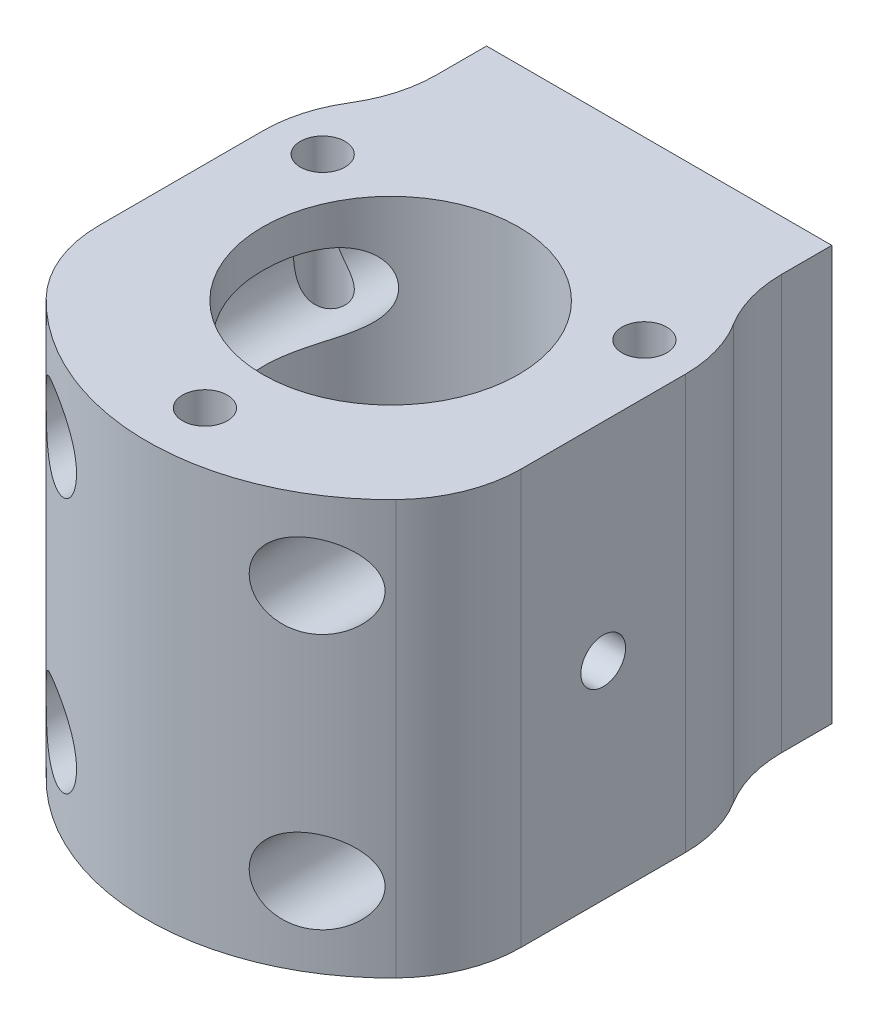
from build123d import *

# Parameters (mm, degrees)
ESQUISSE1_W                  = 27
ESQUISSE1_H                  = 32.4
BOSS_EXTRU_1_DEPTH           = 3
ESQUISSE3_R                  = 10
BOSS_EXTRU_2_DEPTH           = 32.4
CONG_1_R                     = 10
ENL_V_MAT_EXTRU_1_REACH      = 49.216
ESQUISSE2_R                  = 1.5
ENL_V_MAT_EXTRU_2_REACH      = 56.924
ESQUISSE4_R                  = 1.75
R_P_TITION_CIRCULAIRE1_COUNT = 3
ENL_V_MAT_EXTRU_3_REACH      = 46.699
ESQUISSE5_R                  = 3.25
ENL_V_MAT_EXTRU_5_REACH      = 56.924
CONG_2_R                     = 10
ENL_V_MAT_EXTRU_6_REACH      = 56.364
ESQUISSE8_R                  = 1.75
ENL_V_MAT_EXTRU_7_REACH      = 54.597
ENL_V_MAT_EXTRU_7_END_RADIUS = 10


with BuildPart() as part:
    # Esquisse1 → Boss.-Extru.1 (new body)
    with BuildSketch(Plane.XY):
        Rectangle(ESQUISSE1_W, ESQUISSE1_H)
    extrude(amount=BOSS_EXTRU_1_DEPTH)

    # Esquisse3 → Boss.-Extru.2 (add)
    with BuildSketch(Plane.XZ.offset(16.2)):
        with BuildLine():
            Line((-13.5, 3), (-13.5, 7.559296893))
            ThreePointArc((-13.5, 7.559296893), (0, 40.05), (13.5, 7.559296893))
            Line((13.5, 7.559296893), (13.5, 3))
            Line((13.5, 3), (13.5, 0))
            Line((13.5, 0), (-13.5, 0))
            Line((-13.5, 0), (-13.5, 3))
        make_face()
        with Locations(Location((0, 21, 0), (0, 0, 270))):
            Circle(ESQUISSE3_R, mode=Mode.SUBTRACT)
    extrude(amount=-BOSS_EXTRU_2_DEPTH)

    # Congé1
    cong_1_edges = [part.edges().sort_by_distance(p)[0] for p in [
        (13.5, 0, 7.559296893),
        (-13.5, 0, 7.559296893),
    ]]
    fillet(cong_1_edges, radius=CONG_1_R)

    # Esquisse2 → Enlèv. mat.-Extru.1 (cut, up to next)
    with BuildSketch(Plane.XY, mode=Mode.PRIVATE) as enl_v_mat_extru_1_sk1:
        with Locations(Location((-10, 10, 0), (0, 0, 180))):
            Circle(ESQUISSE2_R)
    enl_v_mat_extru_1_tool1 = extrude(enl_v_mat_extru_1_sk1.sketch, amount=ENL_V_MAT_EXTRU_1_REACH, mode=Mode.PRIVATE) & part.part
    # Esquisse2 → Enlèv. mat.-Extru.1 (cut, up to next)
    with BuildSketch(Plane.XY, mode=Mode.PRIVATE) as enl_v_mat_extru_1_sk2:
        with Locations(Location((10, 10, 0), (0, 0, 180))):
            Circle(ESQUISSE2_R)
    enl_v_mat_extru_1_tool2 = extrude(enl_v_mat_extru_1_sk2.sketch, amount=ENL_V_MAT_EXTRU_1_REACH, mode=Mode.PRIVATE) & part.part
    # Esquisse2 → Enlèv. mat.-Extru.1 (cut, up to next)
    with BuildSketch(Plane.XY, mode=Mode.PRIVATE) as enl_v_mat_extru_1_sk3:
        with Locations(Location((10, -10, 0), (0, 0, 180))):
            Circle(ESQUISSE2_R)
    enl_v_mat_extru_1_tool3 = extrude(enl_v_mat_extru_1_sk3.sketch, amount=ENL_V_MAT_EXTRU_1_REACH, mode=Mode.PRIVATE) & part.part
    # Esquisse2 → Enlèv. mat.-Extru.1 (cut, up to next)
    with BuildSketch(Plane.XY, mode=Mode.PRIVATE) as enl_v_mat_extru_1_sk4:
        with Locations(Location((-10, -10, 0), (0, 0, 180))):
            Circle(ESQUISSE2_R)
    enl_v_mat_extru_1_tool4 = extrude(enl_v_mat_extru_1_sk4.sketch, amount=ENL_V_MAT_EXTRU_1_REACH, mode=Mode.PRIVATE) & part.part
    add(enl_v_mat_extru_1_tool1.solids().sort_by_distance((-10, 10, 0))[0], mode=Mode.SUBTRACT)
    add(enl_v_mat_extru_1_tool2.solids().sort_by_distance((10, 10, 0))[0], mode=Mode.SUBTRACT)
    add(enl_v_mat_extru_1_tool3.solids().sort_by_distance((10, -10, 0))[0], mode=Mode.SUBTRACT)
    add(enl_v_mat_extru_1_tool4.solids().sort_by_distance((-10, -10, 0))[0], mode=Mode.SUBTRACT)

    # Esquisse4 → Enlèv. mat.-Extru.2 (cut, up to next)
    with BuildSketch(Plane(origin=(0, 16.2, 0), x_dir=(1, 0, 0), z_dir=(0, 1, 0)), mode=Mode.PRIVATE) as enl_v_mat_extru_2_sk1:
        with Locations(Location((0, -35.525, 0), (0, 0, 270))):
            Circle(ESQUISSE4_R)
    enl_v_mat_extru_2_tool1 = extrude(enl_v_mat_extru_2_sk1.sketch, amount=-ENL_V_MAT_EXTRU_2_REACH, mode=Mode.PRIVATE) & part.part
    enl_v_mat_extru_2 = enl_v_mat_extru_2_tool1.solids().sort_by_distance((0, 16.2, 35.525))[0]
    add(enl_v_mat_extru_2, mode=Mode.SUBTRACT)

    # Répétition circulaire1: Enlèv. mat.-Extru.2 ×3 about axis
    r_p_tition_circulaire1_axis = Axis((0, 0, 21), (0, 1, 0))
    for i in range(1, R_P_TITION_CIRCULAIRE1_COUNT):
        add(enl_v_mat_extru_2.rotate(r_p_tition_circulaire1_axis, i * 360 / R_P_TITION_CIRCULAIRE1_COUNT), mode=Mode.SUBTRACT)

    # Esquisse5 → Enlèv. mat.-Extru.3 (cut, up to next)
    with BuildSketch(Plane(origin=(0, 0, 3), x_dir=(-1, 0, 0), z_dir=(0, 0, -1)), mode=Mode.PRIVATE) as enl_v_mat_extru_3_sk1:
        with Locations((-10, 10)):
            Circle(ESQUISSE5_R)
    enl_v_mat_extru_3_tool1 = extrude(enl_v_mat_extru_3_sk1.sketch, amount=-ENL_V_MAT_EXTRU_3_REACH, mode=Mode.PRIVATE) & part.part
    # Esquisse5 → Enlèv. mat.-Extru.3 (cut, up to next)
    with BuildSketch(Plane(origin=(0, 0, 3), x_dir=(-1, 0, 0), z_dir=(0, 0, -1)), mode=Mode.PRIVATE) as enl_v_mat_extru_3_sk2:
        with Locations((10, 10)):
            Circle(ESQUISSE5_R)
    enl_v_mat_extru_3_tool2 = extrude(enl_v_mat_extru_3_sk2.sketch, amount=-ENL_V_MAT_EXTRU_3_REACH, mode=Mode.PRIVATE) & part.part
    # Esquisse5 → Enlèv. mat.-Extru.3 (cut, up to next)
    with BuildSketch(Plane(origin=(0, 0, 3), x_dir=(-1, 0, 0), z_dir=(0, 0, -1)), mode=Mode.PRIVATE) as enl_v_mat_extru_3_sk3:
        with Locations((-10, -10)):
            Circle(ESQUISSE5_R)
    enl_v_mat_extru_3_tool3 = extrude(enl_v_mat_extru_3_sk3.sketch, amount=-ENL_V_MAT_EXTRU_3_REACH, mode=Mode.PRIVATE) & part.part
    # Esquisse5 → Enlèv. mat.-Extru.3 (cut, up to next)
    with BuildSketch(Plane(origin=(0, 0, 3), x_dir=(-1, 0, 0), z_dir=(0, 0, -1)), mode=Mode.PRIVATE) as enl_v_mat_extru_3_sk4:
        with Locations((10, -10)):
            Circle(ESQUISSE5_R)
    enl_v_mat_extru_3_tool4 = extrude(enl_v_mat_extru_3_sk4.sketch, amount=-ENL_V_MAT_EXTRU_3_REACH, mode=Mode.PRIVATE) & part.part
    add(enl_v_mat_extru_3_tool1.solids().sort_by_distance((10, 10, 3))[0], mode=Mode.SUBTRACT)
    add(enl_v_mat_extru_3_tool2.solids().sort_by_distance((-10, 10, 3))[0], mode=Mode.SUBTRACT)
    add(enl_v_mat_extru_3_tool3.solids().sort_by_distance((10, -10, 3))[0], mode=Mode.SUBTRACT)
    add(enl_v_mat_extru_3_tool4.solids().sort_by_distance((-10, -10, 3))[0], mode=Mode.SUBTRACT)

    # Esquisse7 → Enlèv. mat.-Extru.5 (cut, up to next)
    with BuildSketch(Plane(origin=(0, 16.2, 0), x_dir=(1, 0, 0), z_dir=(0, 1, 0)), mode=Mode.PRIVATE) as enl_v_mat_extru_5_sk1:
        with BuildLine():
            Line((-16.5, -11.478839356), (-16.5, -30.521160644))
            ThreePointArc((-16.5, -30.521160644), (-19.05, -21), (-16.5, -11.478839356))
        make_face()
    enl_v_mat_extru_5_tool1 = extrude(enl_v_mat_extru_5_sk1.sketch, amount=-ENL_V_MAT_EXTRU_5_REACH, mode=Mode.PRIVATE) & part.part
    # Esquisse7 → Enlèv. mat.-Extru.5 (cut, up to next)
    with BuildSketch(Plane(origin=(0, 16.2, 0), x_dir=(1, 0, 0), z_dir=(0, 1, 0)), mode=Mode.PRIVATE) as enl_v_mat_extru_5_sk2:
        with BuildLine():
            Line((16.5, -30.521160644), (16.5, -11.478839356))
            ThreePointArc((16.5, -11.478839356), (19.05, -21), (16.5, -30.521160644))
        make_face()
    enl_v_mat_extru_5_tool2 = extrude(enl_v_mat_extru_5_sk2.sketch, amount=-ENL_V_MAT_EXTRU_5_REACH, mode=Mode.PRIVATE) & part.part
    add(enl_v_mat_extru_5_tool1.solids().sort_by_distance((-17.526088, 16.2, 21))[0], mode=Mode.SUBTRACT)
    add(enl_v_mat_extru_5_tool2.solids().sort_by_distance((17.526088, 16.2, 21))[0], mode=Mode.SUBTRACT)

    # Congé2
    cong_2_edges = [part.edges().sort_by_distance(p)[0] for p in [
        (16.5, 0, 11.478839356),
        (16.5, 0, 30.521160644),
        (-16.5, 0, 30.521160644),
        (-16.5, 0, 11.478839356),
    ]]
    fillet(cong_2_edges, radius=CONG_2_R)

    # Enlèv. mat.-Extru.6: up to this face of the body (flat: up to its plane)
    enl_v_mat_extru_6_end = Plane(part.part.faces().sort_by_distance((16.5, 0, 20.877420173))[0])
    # Esquisse8 → Enlèv. mat.-Extru.6 (cut, up to the picked face)
    with BuildSketch(Plane.ZY.offset(16.5), mode=Mode.PRIVATE) as enl_v_mat_extru_6_sk1:
        with Locations((20.877420173, 0)):
            Circle(ESQUISSE8_R)
    enl_v_mat_extru_6_tool1 = split(extrude(enl_v_mat_extru_6_sk1.sketch, amount=-ENL_V_MAT_EXTRU_6_REACH, mode=Mode.PRIVATE), bisect_by=enl_v_mat_extru_6_end, keep=Keep.BOTH, mode=Mode.PRIVATE)
    add(enl_v_mat_extru_6_tool1.solids().sort_by(Axis((-16.5, 0, 20.87742), (1, 0, 0)))[0], mode=Mode.SUBTRACT)

    # Enlèv. mat.-Extru.7: up to this cylinder (the profile starts outside it)
    enl_v_mat_extru_7_end = Plane(origin=(0, 0, 21), z_dir=(0, -1, 0)) * Cylinder(ENL_V_MAT_EXTRU_7_END_RADIUS, 130.194, mode=Mode.PRIVATE)
    # Esquisse9 → Enlèv. mat.-Extru.7 (cut, up to the surface)
    with BuildSketch(Plane.ZY.offset(13.5), mode=Mode.PRIVATE) as enl_v_mat_extru_7_sk1:
        Polygon((24.341521788, 0), (22.60947098, 3), (19.145369365, 3), (17.413318557, 0), (19.145369365, -3), (22.60947098, -3), align=None)
    enl_v_mat_extru_7_tool1 = extrude(enl_v_mat_extru_7_sk1.sketch, amount=-ENL_V_MAT_EXTRU_7_REACH, mode=Mode.PRIVATE) - enl_v_mat_extru_7_end
    enl_v_mat_extru_7 = enl_v_mat_extru_7_tool1.solids().sort_by_distance((-13.5, 0, 20.87742))[0]
    add(enl_v_mat_extru_7, mode=Mode.SUBTRACT)

    # Symétrie1: Enlèv. mat.-Extru.7 across plane
    add(enl_v_mat_extru_7.mirror(Plane(origin=(0, 0, 0), x_dir=(0, 0, 1), z_dir=(1, 0, 0))), mode=Mode.SUBTRACT)


solid = part.part
